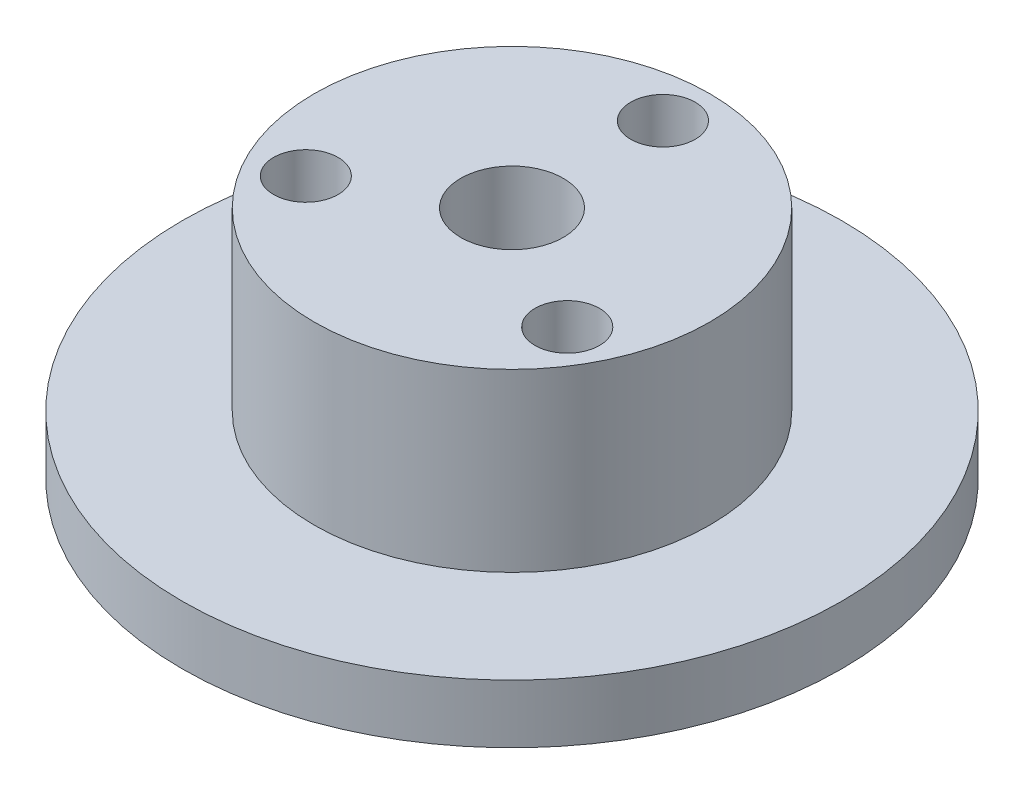
from build123d import *

# Parameters (mm, degrees)
SKETCH_1_R          = 11.25
EXTRUDE_1_DEPTH     = 8
CUT_EXTRUDE_START   = -6
SKETCH_3_R          = 11.25
SKETCH_3_R_2        = 6.75
CUT_EXTRUDE_1_DEPTH = 6
SKETCH_4_R          = 1.75
SKETCH_4_R_2        = 1.1
CUT_EXTRUDE_2_DEPTH = 18.808003819


with BuildPart() as part:
    # 草图1 → 凸台-拉伸1 (new body)
    with BuildSketch(Plane(origin=(0, 0, 0), x_dir=(1, 0, 0), z_dir=(0, 1, 0))):
        with Locations(Location((0, 0, 0), (0, 0, 270))):
            Circle(SKETCH_1_R)
    extrude(amount=EXTRUDE_1_DEPTH)

    # 草图3 → 切除-拉伸1 (cut)
    with BuildSketch(Plane(origin=(0, 8, 0), x_dir=(1, 0, 0), z_dir=(0, 1, 0)).offset(CUT_EXTRUDE_START)):
        with Locations(Location((0, 0, 0), (0, 0, 270))):
            Circle(SKETCH_3_R)
        with Locations(Location((0, 0, 0), (0, 0, 270))):
            Circle(SKETCH_3_R_2, mode=Mode.SUBTRACT)
    extrude(amount=CUT_EXTRUDE_1_DEPTH, mode=Mode.SUBTRACT)

    # 草图4 → 切除-拉伸2 (cut, through all)
    with BuildSketch(Plane(origin=(0, 8, 0), x_dir=(1, 0, 0), z_dir=(0, 1, 0))):
        with Locations(Location((0, 0, 0), (0, 0, 270))):
            Circle(SKETCH_4_R)
        with Locations(Location((0, 5.15, 0), (0, 0, 270))):
            Circle(SKETCH_4_R_2)
        with Locations(Location((4.460030829, -2.575, 0), (0, 0, 270))):
            Circle(SKETCH_4_R_2)
        with Locations(Location((-4.460030829, -2.575, 0), (0, 0, 270))):
            Circle(SKETCH_4_R_2)
    extrude(amount=-CUT_EXTRUDE_2_DEPTH, mode=Mode.SUBTRACT)


solid = part.part
